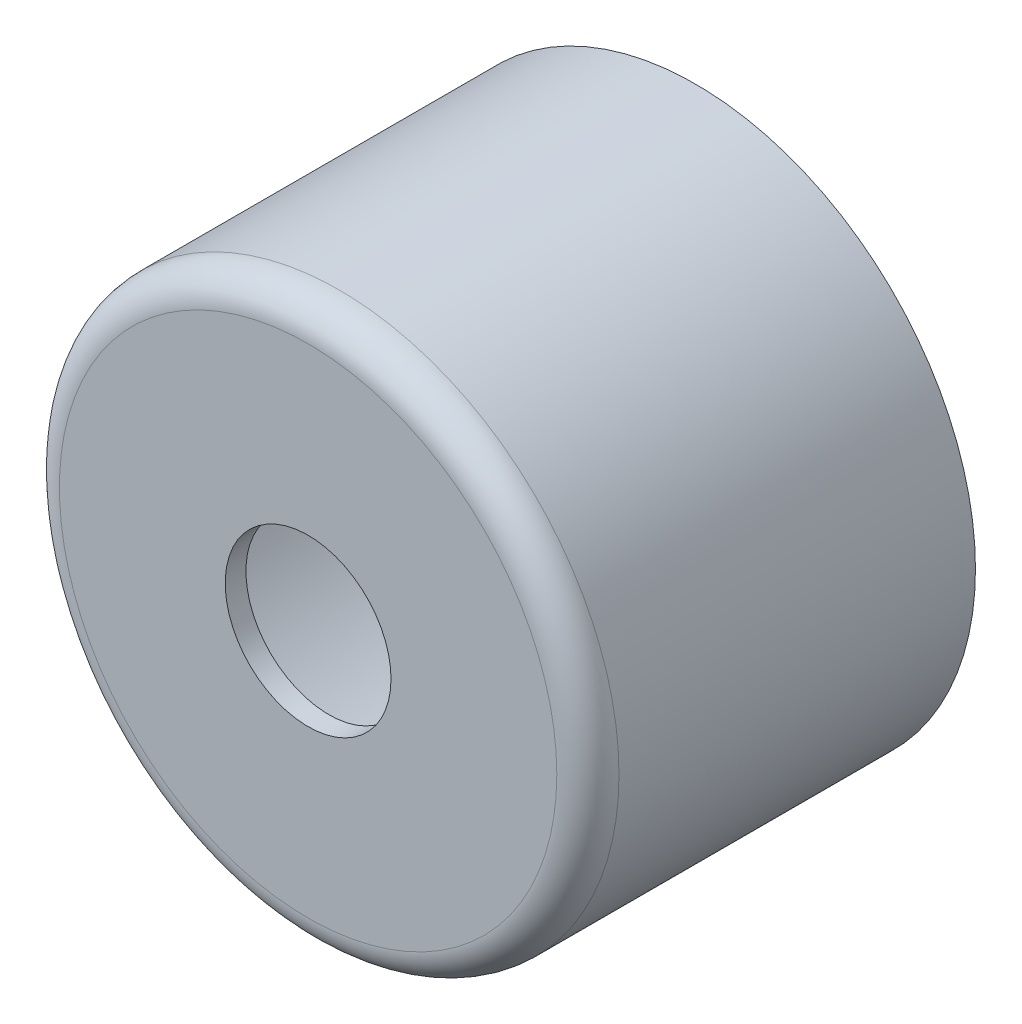
from build123d import *

# Parameters (mm, degrees)
ESQUISSE1_R             = 13.5
EXTRUSION1_DEPTH        = 18.7
CONG_1_R                = 1.5
COQUE1_T                = -1
ESQUISSE2_R             = 4
ENL_V_MAT_EXTRU_1_DEPTH = 27.724333481


with BuildPart() as part:
    # Esquisse1 → Extrusion1 (new body)
    with BuildSketch(Plane.XY):
        Circle(ESQUISSE1_R)
    extrude(amount=EXTRUSION1_DEPTH)

    # Congé1
    cong_1_edges = [part.edges().sort_by_distance(p)[0] for p in [
        (-13.5, 0, 18.7),
    ]]
    fillet(cong_1_edges, radius=CONG_1_R)

    # Coque1
    coque1_openings = [part.faces().sort_by_distance(p)[0] for p in [
        (0, 0, 0),
    ]]
    offset(amount=COQUE1_T, openings=coque1_openings, kind=Kind.INTERSECTION)

    # Esquisse2 → Enlèv. mat.-Extru.1 (cut, through all)
    with BuildSketch(Plane.XY.offset(18.7)):
        Circle(ESQUISSE2_R)
    extrude(amount=-ENL_V_MAT_EXTRU_1_DEPTH, mode=Mode.SUBTRACT)


solid = part.part
